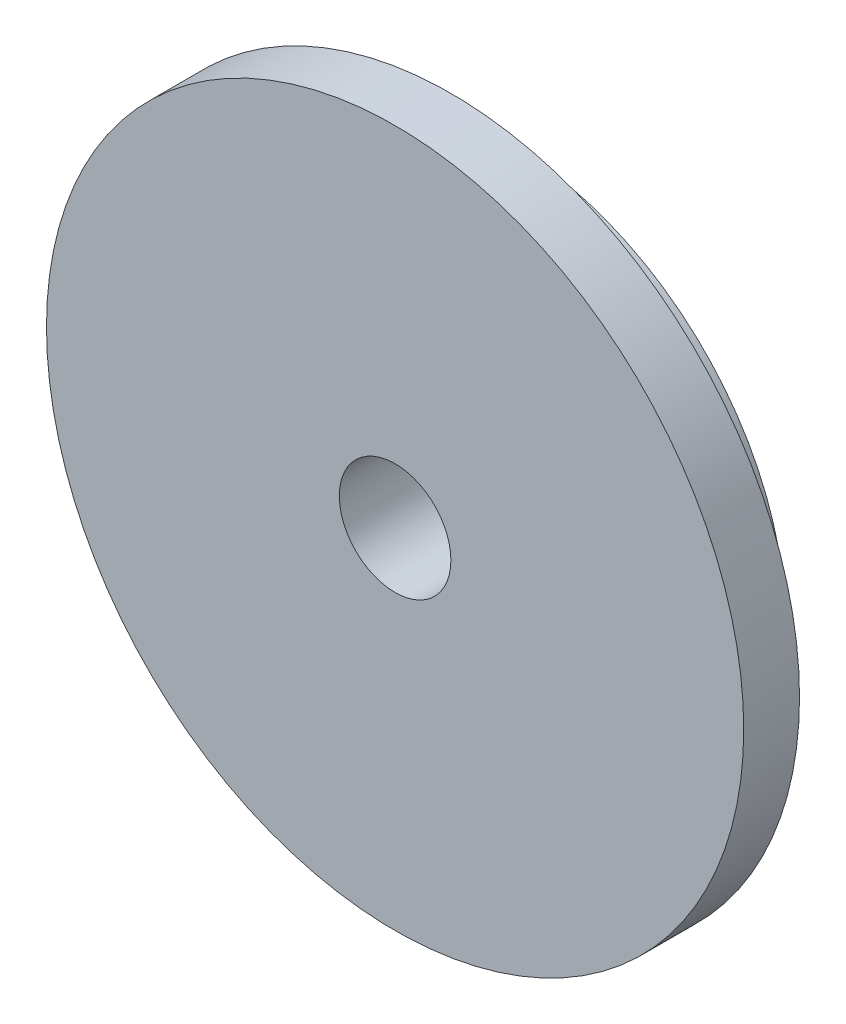
from build123d import *

# Parameters (mm, degrees)
SKETCH1_R           = 10
SKETCH1_R_2         = 2
BOSS_EXTRUDE1_DEPTH = 4
BOSS_EXTRUDE2_START = -2
SKETCH2_R           = 12.5
SKETCH2_R_2         = 10
BOSS_EXTRUDE2_DEPTH = 2


with BuildPart() as part:
    # Sketch1 → Boss-Extrude1 (new body)
    with BuildSketch(Plane.XY):
        Circle(SKETCH1_R)
        Circle(SKETCH1_R_2, mode=Mode.SUBTRACT)
    extrude(amount=BOSS_EXTRUDE1_DEPTH)

    # Sketch2 → Boss-Extrude2 (add)
    with BuildSketch(Plane.XY.offset(4).offset(BOSS_EXTRUDE2_START)):
        Circle(SKETCH2_R)
        Circle(SKETCH2_R_2, mode=Mode.SUBTRACT)
    extrude(amount=BOSS_EXTRUDE2_DEPTH)


solid = part.part
